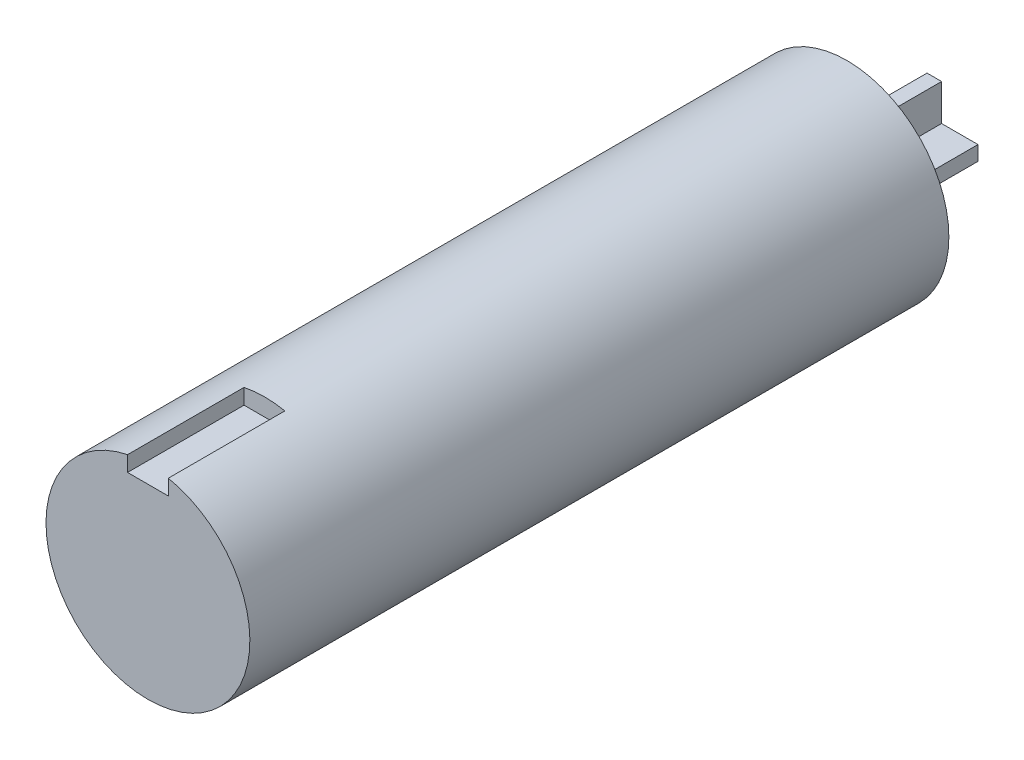
from build123d import *

# Parameters (mm, degrees)
SKETCH_1_W          = 2.5
SKETCH_1_H          = 6.25
SKETCH_1_W_2        = 6.25
SKETCH_1_H_2        = 2.5
EXTRUDE_1_DEPTH     = 15
SKETCH_2_R          = 17.5
EXTRUDE_2_DEPTH     = 120
SKETCH_3_W          = 7
SKETCH_3_H          = 20
CUT_EXTRUDE_1_DEPTH = 3


with BuildPart() as part:
    # 草图1 → 凸台-拉伸1 (new body)
    with BuildSketch(Plane.XY):
        with Locations((0, 4.375)):
            Rectangle(SKETCH_1_W, SKETCH_1_H)
        with Locations((-4.375, 0)):
            Rectangle(SKETCH_1_W_2, SKETCH_1_H_2)
        with Locations((4.375, 0)):
            Rectangle(SKETCH_1_W_2, SKETCH_1_H_2)
        with Locations((0, -4.375)):
            Rectangle(SKETCH_1_W, SKETCH_1_H)
        Rectangle(SKETCH_1_W, SKETCH_1_H_2)
    extrude(amount=-EXTRUDE_1_DEPTH)

    # 草图2 → 凸台-拉伸2 (add)
    with BuildSketch(Plane.XY):
        Circle(SKETCH_2_R)
    extrude(amount=EXTRUDE_2_DEPTH)

    # 草图3 → 切除-拉伸1 (cut)
    with BuildSketch(Plane(origin=(0, 17.5, 0), x_dir=(1, 0, 0), z_dir=(0, 1, 0))):
        with Locations((0, -110)):
            Rectangle(SKETCH_3_W, SKETCH_3_H)
    extrude(amount=-CUT_EXTRUDE_1_DEPTH, mode=Mode.SUBTRACT)


solid = part.part
